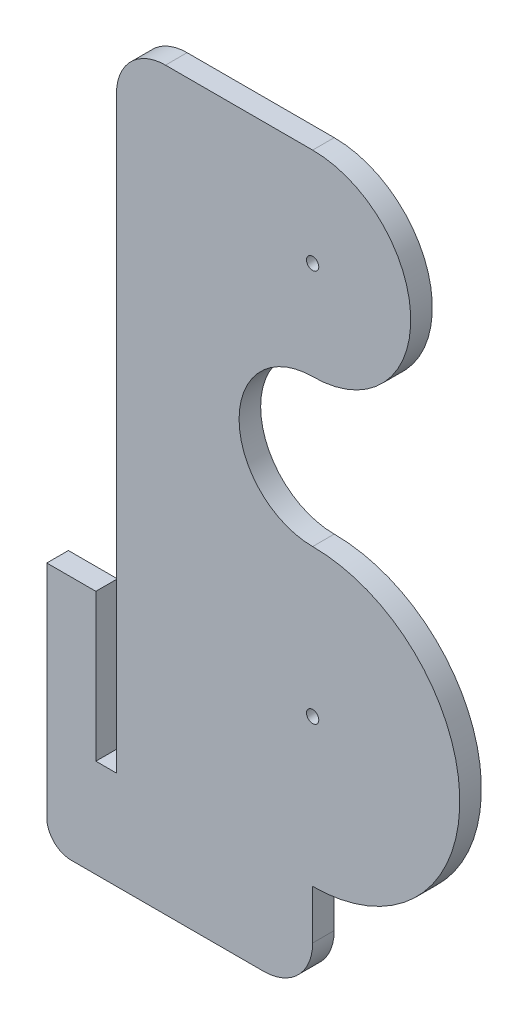
from build123d import *

# Parameters (mm, degrees)
SKETCH1_R           = 0.79375
BOSS_EXTRUDE1_DEPTH = 2.794
FILLET1_R           = 6.35
FILLET2_R           = 3.175


with BuildPart() as part:
    # Sketch1 → Boss-Extrude1 (new body)
    with BuildSketch(Plane.XY):
        with BuildLine():
            Line((-15.237072382, 13.269795383), (-8.887072382, 13.269795383))
            Line((-8.887072382, 13.269795383), (-8.887072382, -5.780204617))
            Line((-8.887072382, -5.780204617), (-6.220072382, -5.780204617))
            Line((-6.220072382, -5.780204617), (-6.220072382, 32.313013632))
            Line((-6.220072382, 32.313013632), (-6.220072382, 76.769795383))
            Line((-6.220072382, 76.769795383), (19.179927297, 76.769795383))
            ThreePointArc((19.179927297, 76.769795383), (31.879927297, 64.069795092), (19.179926715, 51.369795383))
            ThreePointArc((19.179926715, 51.369795383), (9.654926277, 41.844795383), (19.179926715, 32.319795383))
            ThreePointArc((19.179926715, 32.319795383), (38.229927618, 13.269795835), (19.179927618, -5.780204617))
            Line((19.179927618, -5.780204617), (19.179927618, -18.480204617))
            Line((19.179927618, -18.480204617), (-15.237072382, -18.480204617))
            Line((-15.237072382, -18.480204617), (-15.237072382, 13.269795383))
        make_face()
        with Locations((19.179927618, 13.269795383)):
            Circle(SKETCH1_R, mode=Mode.SUBTRACT)
        with Locations((19.179927618, 64.069795383)):
            Circle(SKETCH1_R, mode=Mode.SUBTRACT)
    extrude(amount=BOSS_EXTRUDE1_DEPTH)

    # Fillet1
    fillet1_edges = [part.edges().sort_by_distance(p)[0] for p in [
        (19.179927618, -18.480204617, 1.397),
        (-6.220072382, 76.769795383, 1.397),
    ]]
    fillet(fillet1_edges, radius=FILLET1_R)

    # Fillet2
    fillet2_edges = [part.edges().sort_by_distance(p)[0] for p in [
        (-15.237072382, -18.480204617, 1.397),
    ]]
    fillet(fillet2_edges, radius=FILLET2_R)


solid = part.part
